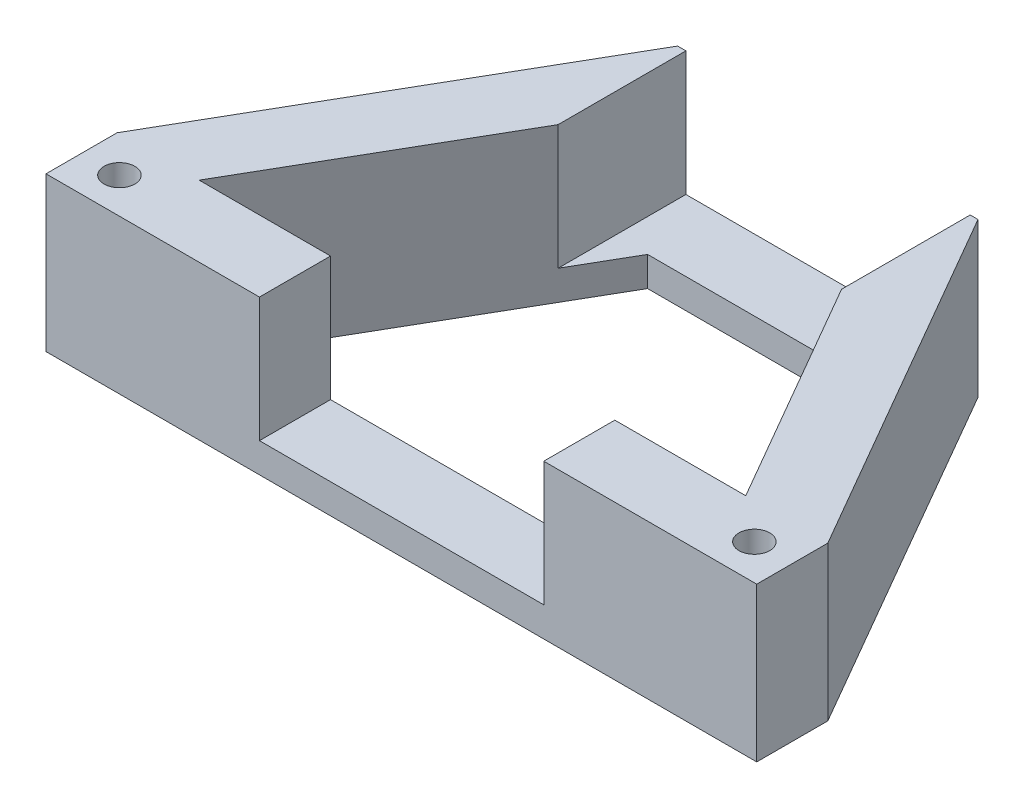
from build123d import *

# Parameters (mm, degrees)
BOSS_EXTRUDE1_DEPTH = 16.51
SKETCH2_R           = 1.651
CUT_EXTRUDE1_DEPTH  = 16.51
SKETCH3_W           = 30.48
SKETCH3_H           = 45.72
CUT_EXTRUDE2_DEPTH  = 13.335


with BuildPart() as part:
    # Sketch1 → Boss-Extrude1 (new body)
    with BuildSketch(Plane(origin=(0, 0, 0), x_dir=(1, 0, 0), z_dir=(0, 1, 0))):
        Polygon((-26.766598834, -7.489394136), (-4.769553578, 30.610605864), (27.43635591, 30.610605864), (49.433401166, -7.489394136), (49.433401166, -15.109394136), (-26.766598834, -15.109394136), align=None)
        Polygon((-17.967780731, -7.489394136), (40.634583064, -7.489394136), (23.036946859, 22.990605864), (-0.370144526, 22.990605864), align=None, mode=Mode.SUBTRACT)
    extrude(amount=BOSS_EXTRUDE1_DEPTH)

    # Sketch2 → Cut-Extrude1 (cut)
    with BuildSketch(Plane(origin=(0, 16.51, 0), x_dir=(1, 0, 0), z_dir=(0, 1, 0))):
        with Locations(Location((-22.702598834, -11.299394136, 0), (0, 0, 270))):
            Circle(SKETCH2_R)
        with Locations(Location((45.369401166, -11.299394136, 0), (0, 0, 270))):
            Circle(SKETCH2_R)
    extrude(amount=-CUT_EXTRUDE1_DEPTH, mode=Mode.SUBTRACT)

    # Sketch3 → Cut-Extrude2 (cut)
    with BuildSketch(Plane(origin=(0, 16.51, 0), x_dir=(1, 0, 0), z_dir=(0, 1, 0))):
        with Locations((11.359446422, 7.750605864)):
            Rectangle(SKETCH3_W, SKETCH3_H)
    extrude(amount=-CUT_EXTRUDE2_DEPTH, mode=Mode.SUBTRACT)


solid = part.part
